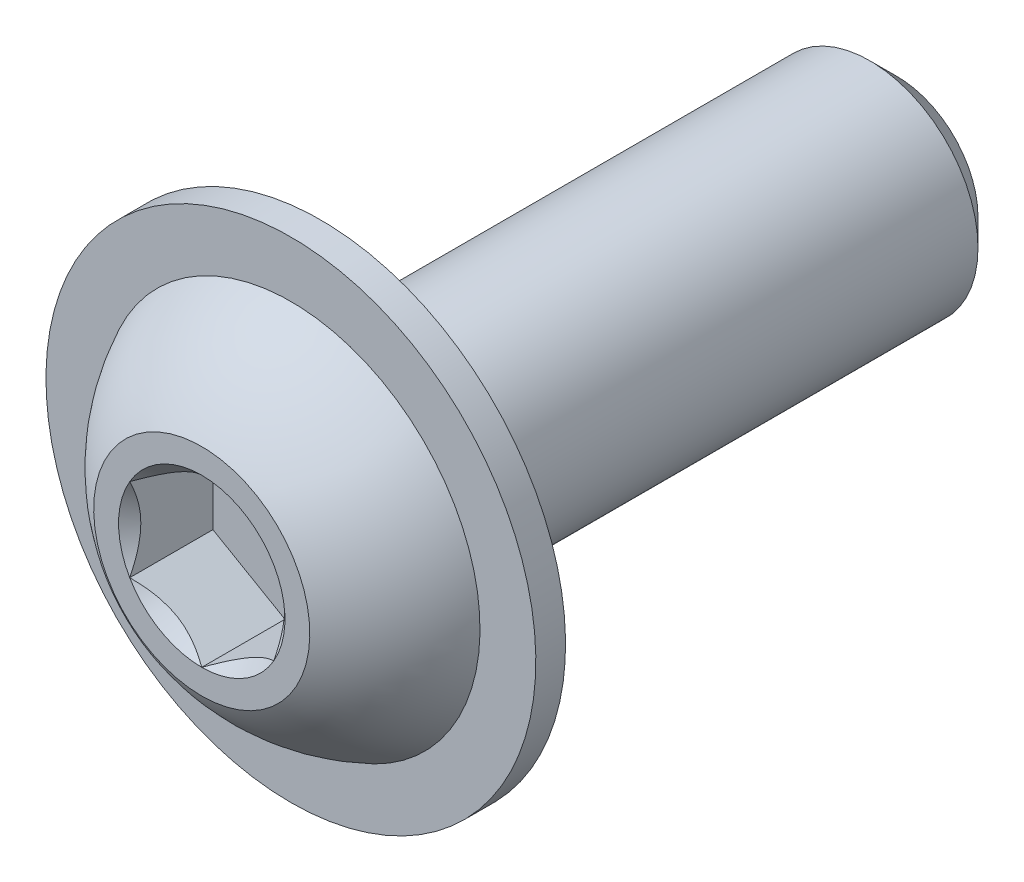
from build123d import *

# Parameters (mm, degrees)
SKETCH13_W         = 16
SKETCH13_H         = 3
CHAMFER1_SIZE      = 0.75
CUT_EXTRUDE2_DEPTH = 2.31


with BuildPart() as part:
    # Sketch13 → Revolve1 (revolve)
    with BuildSketch(Plane(origin=(0, 0, 0), x_dir=(0, 0, -1), z_dir=(1, 0, 0)), mode=Mode.PRIVATE) as revolve1_sk:
        with Locations((1.65, 1.5)):
            Rectangle(SKETCH13_W, SKETCH13_H)
    revolve(revolve1_sk.sketch.rotate(Axis((0, 0, 9.65), (0, 0, -1)), 90), axis=Axis((0, 0, 9.65), (0, 0, -1)))

    # Chamfer1
    chamfer1_edges = [part.edges().sort_by_distance(p)[0] for p in [
        (-3, 0, -9.65),
    ]]
    chamfer(chamfer1_edges, length=CHAMFER1_SIZE)

    # Sketch7 → Revolve2 (revolve)
    with BuildSketch(Plane(origin=(0, 0, 0), x_dir=(0, 0, -1), z_dir=(1, 0, 0)), mode=Mode.PRIVATE) as revolve2_sk:
        with BuildLine():
            Line((-6.35, 5.25), (-6.35, 0))
            Line((-6.35, 0), (-9.65, 0))
            Line((-9.65, 0), (-9.65, 3))
            ThreePointArc((-9.65, 3), (-8.577614941, 4.306626435), (-7.175, 5.25))
            Line((-7.175, 5.25), (-7.175, 6.8))
            Line((-7.175, 6.8), (-6.35, 6.8))
            Line((-6.35, 6.8), (-6.35, 5.25))
        make_face()
    revolve(revolve2_sk.sketch.rotate(Axis((0, 0, 9.65), (0, 0, -1)), 180), axis=Axis((0, 0, 9.65), (0, 0, -1)))

    # Sketch5 → Cut-Extrude2 (cut)
    with BuildSketch(Plane.XY.offset(9.65)):
        Polygon((2, -1.154700538), (2, 1.154700538), (0, 2.309401077), (-2, 1.154700538), (-2, -1.154700538), (0, -2.309401077), align=None)
    extrude(amount=-CUT_EXTRUDE2_DEPTH, mode=Mode.SUBTRACT)

    # Cut-Extrude3 cone 1 section (through the dimple's axis) → Cut-Extrude3 (revolve, cut)
    with BuildSketch(Plane(origin=(0, 0, 9.65), x_dir=(0, -1, 0), z_dir=(1, 0, 0))):
        Polygon((0, 0), (2.309401077, 0), (0, 2.309401077), align=None)
    revolve(axis=Axis((0, 0, 9.65), (0, 0, -1)), mode=Mode.SUBTRACT)


solid = part.part
